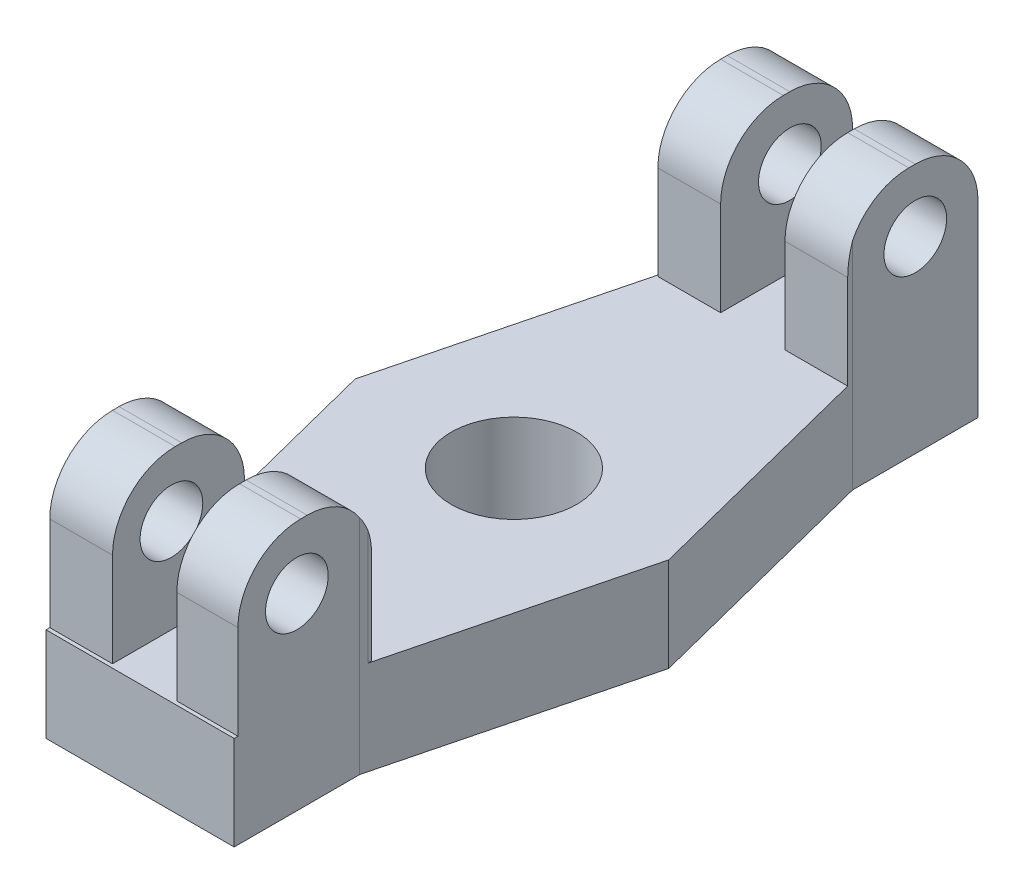
from build123d import *

# Parameters (mm, degrees)
SKETCH1_R           = 10
SKETCH1_W           = 30
SKETCH1_H           = 20
BOSS_EXTRUDE1_DEPTH = 15
BOSS_EXTRUDE2_DEPTH = 25
SKETCH3_R           = 5
CUT_EXTRUDE1_DEPTH  = 58
FILLET1_R           = 10


with BuildPart() as part:
    # Sketch1 → Boss-Extrude1 (new body)
    # profile 1 of 3: a face of its own
    with BuildSketch(Plane(origin=(0, 0, 0), x_dir=(1, 0, 0), z_dir=(0, 1, 0))):
        Polygon((-15, -39.607549464), (-24.990355032, -0.301923542), (-15, 39.00370238), (15, 39.00370238), (24.990355032, -0.301923542), (15, -39.607549464), align=None)
        with Locations(Location((0, 0, 0), (0, 0, 270))):
            Circle(SKETCH1_R, mode=Mode.SUBTRACT)
    # profile 2 of 3: a face of its own
    with BuildSketch(Plane(origin=(0, 0, 0), x_dir=(1, 0, 0), z_dir=(0, 1, 0))):
        with Locations((0, -49.607549464)):
            Rectangle(SKETCH1_W, SKETCH1_H)
    # profile 3 of 3: a face of its own
    with BuildSketch(Plane(origin=(0, 0, 0), x_dir=(1, 0, 0), z_dir=(0, 1, 0))):
        with Locations((0, 49.00370238)):
            Rectangle(SKETCH1_W, SKETCH1_H)
    extrude(amount=BOSS_EXTRUDE1_DEPTH)

    # Sketch2 → Boss-Extrude2 (add)
    with BuildSketch(Plane(origin=(0, 15, 0), x_dir=(1, 0, 0), z_dir=(0, 1, 0))):
        Polygon((15, 59.00370238), (5.264710161, 59.00370238), (5.264710161, 37.962238036), (15.264710161, 37.962238036), (15, 39.00370238), align=None)
        Polygon((-5, 59.00370238), (-15, 59.00370238), (-15, 39.00370238), (-15, 37.962238036), (-5, 37.962238036), align=None)
        Polygon((-5, -59.00370238), (-5, -37.962238036), (-15, -37.962238036), (-15, -39.607549464), (-15, -59.00370238), align=None)
        Polygon((15, -39.607549464), (15.264710161, -38.56608512), (15.264710161, -37.962238036), (5.264710161, -37.962238036), (5.264710161, -59.00370238), (15, -59.00370238), align=None)
    extrude(amount=BOSS_EXTRUDE2_DEPTH)

    # Sketch3 → Cut-Extrude1 (cut)
    with BuildSketch(Plane(origin=(15, 0, 0), x_dir=(0, 0, -1), z_dir=(1, 0, 0))):
        with Locations((-49.607549464, 30)):
            Circle(SKETCH3_R)
        with Locations((49.00370238, 30)):
            Circle(SKETCH3_R)
    extrude(amount=-CUT_EXTRUDE1_DEPTH, mode=Mode.SUBTRACT)

    # Fillet1
    fillet1_edges = [part.edges().sort_by_distance(p)[0] for p in [
        (10.13235508, 40, -59.00370238),
        (10.264710161, 40, -37.962238036),
        (-10, 40, -59.00370238),
        (-10, 40, -37.962238036),
        (10.264710161, 40, 37.962238036),
        (-10, 40, 37.962238036),
        (10.13235508, 40, 59.00370238),
        (-10, 40, 59.00370238),
    ]]
    fillet(fillet1_edges, radius=FILLET1_R)


solid = part.part
